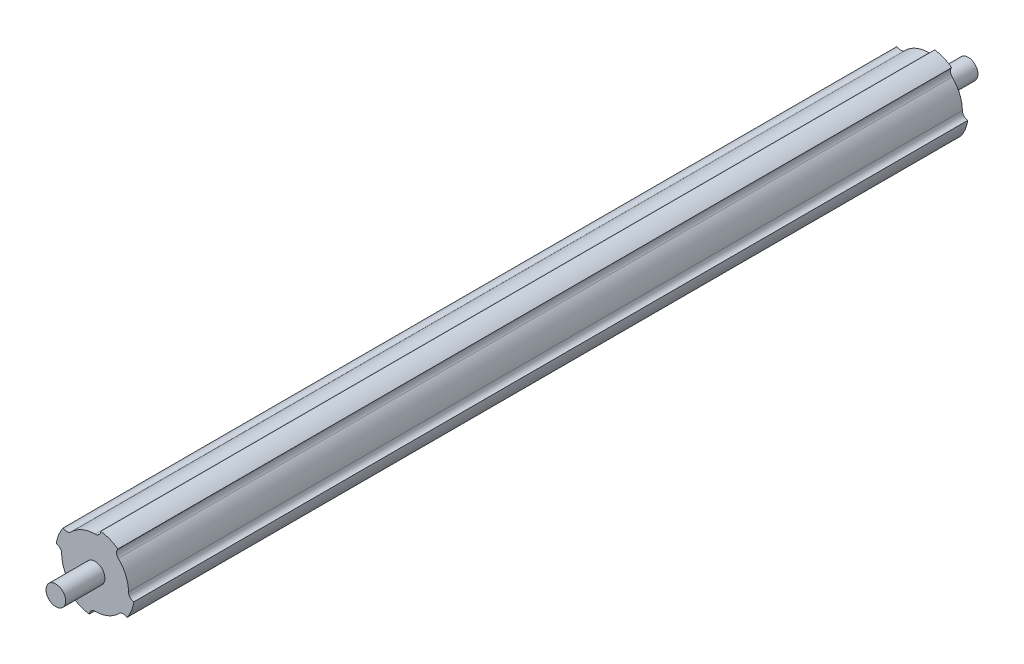
from build123d import *

# Parameters (mm, degrees)
SKETCH1_R           = 25.4
BOSS_EXTRUDE1_DEPTH = 590.55
SKETCH2_OUTSIDE_W   = 171.78
SKETCH2_OUTSIDE_H   = 171.78
SKETCH2_OUTSIDE_R   = 6.361935525
CUT_EXTRUDE1_DEPTH  = 25.4
SKETCH5_OUTSIDE_W   = 171.78
SKETCH5_OUTSIDE_H   = 171.78
SKETCH5_OUTSIDE_R   = 6.377907631
CUT_EXTRUDE4_DEPTH  = 25.4
CUT_EXTRUDE5_DEPTH  = 568.96
CIRPATTERN1_COUNT   = 4


with BuildPart() as part:
    # Sketch1 → Boss-Extrude1 (new body)
    with BuildSketch(Plane.XY):
        Circle(SKETCH1_R)
    extrude(amount=BOSS_EXTRUDE1_DEPTH)

    # Sketch2 outside → Cut-Extrude1 (cut)
    with BuildSketch(Plane.XY):
        Rectangle(SKETCH2_OUTSIDE_W, SKETCH2_OUTSIDE_H)
        Circle(SKETCH2_OUTSIDE_R, mode=Mode.SUBTRACT)
    extrude(amount=CUT_EXTRUDE1_DEPTH, mode=Mode.SUBTRACT)

    # Sketch5 outside → Cut-Extrude4 (cut)
    with BuildSketch(Plane.XY.offset(590.55)):
        Rectangle(SKETCH5_OUTSIDE_W, SKETCH5_OUTSIDE_H)
        Circle(SKETCH5_OUTSIDE_R, mode=Mode.SUBTRACT)
    extrude(amount=-CUT_EXTRUDE4_DEPTH, mode=Mode.SUBTRACT)

    # Sketch6 → Cut-Extrude5 (cut)
    with BuildSketch(Plane.XY):
        with BuildLine():
            ThreePointArc((29.164386469, 0), (26.85091062, 11.383761989), (20.277517743, 20.961481635))
            ThreePointArc((20.277517743, 20.961481635), (14.954603392, 20.873199153), (15.042885874, 15.550284802))
            ThreePointArc((15.042885874, 15.550284802), (19.919360406, 8.445049073), (21.635613531, 0))
            ThreePointArc((21.635613531, 0), (25.4, -3.764386469), (29.164386469, 0))
        make_face()
    cut_extrude5 = extrude(amount=CUT_EXTRUDE5_DEPTH, mode=Mode.SUBTRACT)

    # CirPattern1: Cut-Extrude5 ×4 about axis
    cirpattern1_axis = Axis((0, 0, 0), (0, 0, 1))
    for i in range(1, CIRPATTERN1_COUNT):
        add(cut_extrude5.rotate(cirpattern1_axis, i * 360 / CIRPATTERN1_COUNT), mode=Mode.SUBTRACT)


solid = part.part
